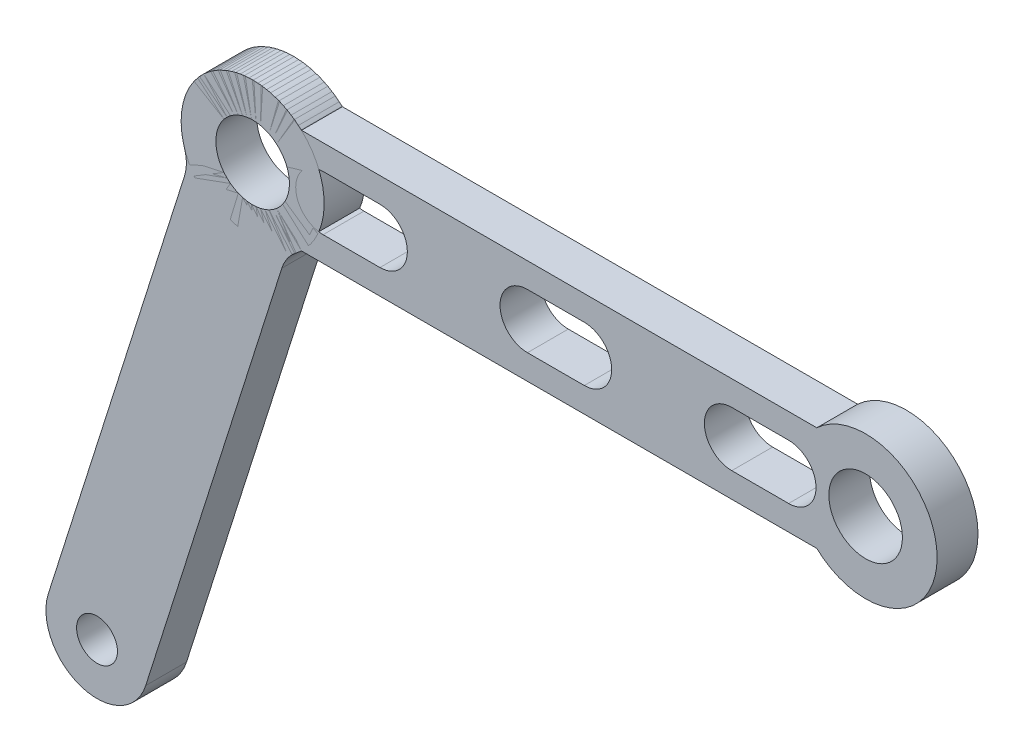
from build123d import *

# Parameters (mm, degrees)
SKETCH1_R           = 9
BOSS_EXTRUDE3_DEPTH = 10
SKETCH2_R           = 9
BOSS_EXTRUDE2_DEPTH = 10
SKETCH3_R           = 5
CUT_EXTRUDE1_DEPTH  = 10
FILLET1_R           = 10


with BuildPart() as part:
    # Sketch1 → Boss-Extrude3 (new body)
    with BuildSketch(Plane.XY):
        with BuildLine():
            Line((-58.704034486, 12.783450444), (67.393380319, 12.783450444))
            ThreePointArc((67.393380319, 12.783450444), (96.844672917, 0), (67.393380319, -12.783450444))
            Line((67.393380319, -12.783450444), (-58.704034486, -12.783450444))
            ThreePointArc((-58.704034486, -12.783450444), (-88.155327083, 0), (-58.704034486, 12.783450444))
        make_face()
        with Locations((-70.655327083, 0)):
            Circle(SKETCH1_R, mode=Mode.SUBTRACT)
        with Locations((79.344672917, 0)):
            Circle(SKETCH1_R, mode=Mode.SUBTRACT)
        with BuildLine():
            Line((-53.412978839, 6.702415671), (-39.501397037, 6.702415671))
            ThreePointArc((-39.501397037, 6.702415671), (-32.798981366, 0), (-39.501397037, -6.702415671))
            Line((-39.501397037, -6.702415671), (-53.412978839, -6.702415671))
            ThreePointArc((-53.412978839, -6.702415671), (-60.11539451, 0), (-53.412978839, 6.702415671))
        make_face(mode=Mode.SUBTRACT)
        with BuildLine():
            Line((-3.412978839, 6.702415671), (10.498602963, 6.702415671))
            ThreePointArc((10.498602963, 6.702415671), (17.201018634, 0), (10.498602963, -6.702415671))
            Line((10.498602963, -6.702415671), (-3.412978839, -6.702415671))
            ThreePointArc((-3.412978839, -6.702415671), (-10.11539451, 0), (-3.412978839, 6.702415671))
        make_face(mode=Mode.SUBTRACT)
        with BuildLine():
            Line((46.587021161, 6.702415671), (60.498602963, 6.702415671))
            ThreePointArc((60.498602963, 6.702415671), (67.201018634, 0), (60.498602963, -6.702415671))
            Line((60.498602963, -6.702415671), (46.587021161, -6.702415671))
            ThreePointArc((46.587021161, -6.702415671), (39.88460549, 0), (46.587021161, 6.702415671))
        make_face(mode=Mode.SUBTRACT)
    extrude(amount=BOSS_EXTRUDE3_DEPTH)


with BuildPart() as body_2:
    # Sketch2 → Boss-Extrude2 (new body)
    with BuildSketch(Plane.XY):
        with BuildLine():
            Line((-62.439507531, -15.451547142), (-96.827928866, -123.959805763))
            ThreePointArc((-96.827928866, -123.959805763), (-112.520226263, -132.09932678), (-120.65974728, -116.407029382))
            Line((-120.65974728, -116.407029382), (-86.271325945, -7.898770761))
            ThreePointArc((-86.271325945, -7.898770761), (-65.368383617, 16.68227289), (-62.439507531, -15.451547142))
        make_face()
        with Locations((-70.655327083, 0)):
            Circle(SKETCH2_R, mode=Mode.SUBTRACT)
    extrude(amount=BOSS_EXTRUDE2_DEPTH)

    # Sketch3 → Cut-Extrude1 (cut)
    with BuildSketch(Plane.XY.offset(10)):
        with Locations((-108.743838073, -120.183417573)):
            Circle(SKETCH3_R)
    extrude(amount=-CUT_EXTRUDE1_DEPTH, mode=Mode.SUBTRACT)

    # Fillet1
    fillet1_edges = [body_2.edges().sort_by_distance(p)[0] for p in [
        (-86.271325945, -7.898770761, 5),
        (-62.439507531, -15.451547142, 5),
    ]]
    fillet(fillet1_edges, radius=FILLET1_R)


solid = Compound([part.part, body_2.part])
